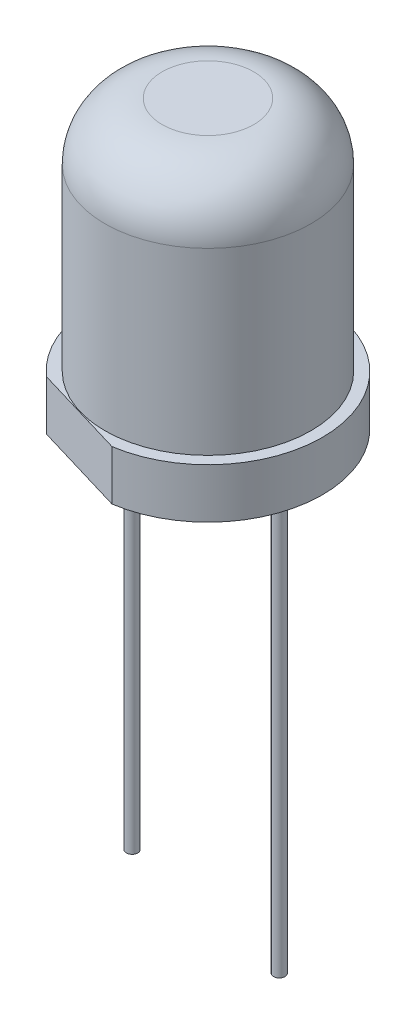
from build123d import *

# Parameters (mm, degrees)
KES_EKSTR_ZYON2_DEPTH = 10
IZIM4_R               = 0.5
IZIM6_R               = 0.5


with BuildPart() as part:
    # Çizim1 → Döndür2 (revolve)
    with BuildSketch(Plane.XY, mode=Mode.PRIVATE) as d_nd_r2_sk:
        with BuildLine():
            Line((0, 0), (10, 0))
            Line((10, 0), (10, 4.346574423))
            Line((10, 4.346574423), (9, 4.346574423))
            Line((9, 4.346574423), (9, 20))
            ThreePointArc((9, 20), (7.535533906, 23.535533906), (4, 25))
            Line((4, 25), (0, 25))
            Line((0, 25), (0, 0))
        make_face()
    revolve(d_nd_r2_sk.sketch.rotate(Axis((0, 25, 0), (0, -1, 0)), 180), axis=Axis((0, 25, 0), (0, -1, 0)))

    # Çizim2 → Kes-Ekstrüzyon2 (cut)
    with BuildSketch(Plane.XZ):
        Polygon((-6.667667497, 7.452664634), (1.504038202, 9.886246461), (0.616082269, 11.592722448), (-7.506944277, 10), align=None)
    extrude(amount=-KES_EKSTR_ZYON2_DEPTH, mode=Mode.SUBTRACT)

    # Süpür1: sweep along a curve in space
    with BuildLine() as s_p_r1_path:
        Line((-1.443878782, 1.853325266, 5.182498136), (-1.443878782, -29.967465354, 5.182498136))
    # Çizim4 → Süpür1 (sweep)
    with BuildSketch(Plane(origin=(-1.443878782, -29.967465354, 5.182498136), x_dir=(-1, 0, 0), z_dir=(0, -1, 0))):
        Circle(IZIM4_R)
    sweep(path=s_p_r1_path.line)

    # Süpür2: sweep along a curve in space
    with BuildLine() as s_p_r2_path:
        Line((1.793792857, 0, -4.435841685), (1.793792857, -42.508039012, -4.435841685))
    # Çizim6 → Süpür2 (sweep)
    with BuildSketch(Plane(origin=(1.793792857, -42.508039012, -4.435841685), x_dir=(-1, 0, 0), z_dir=(0, -1, 0))):
        Circle(IZIM6_R)
    sweep(path=s_p_r2_path.line)


solid = part.part
